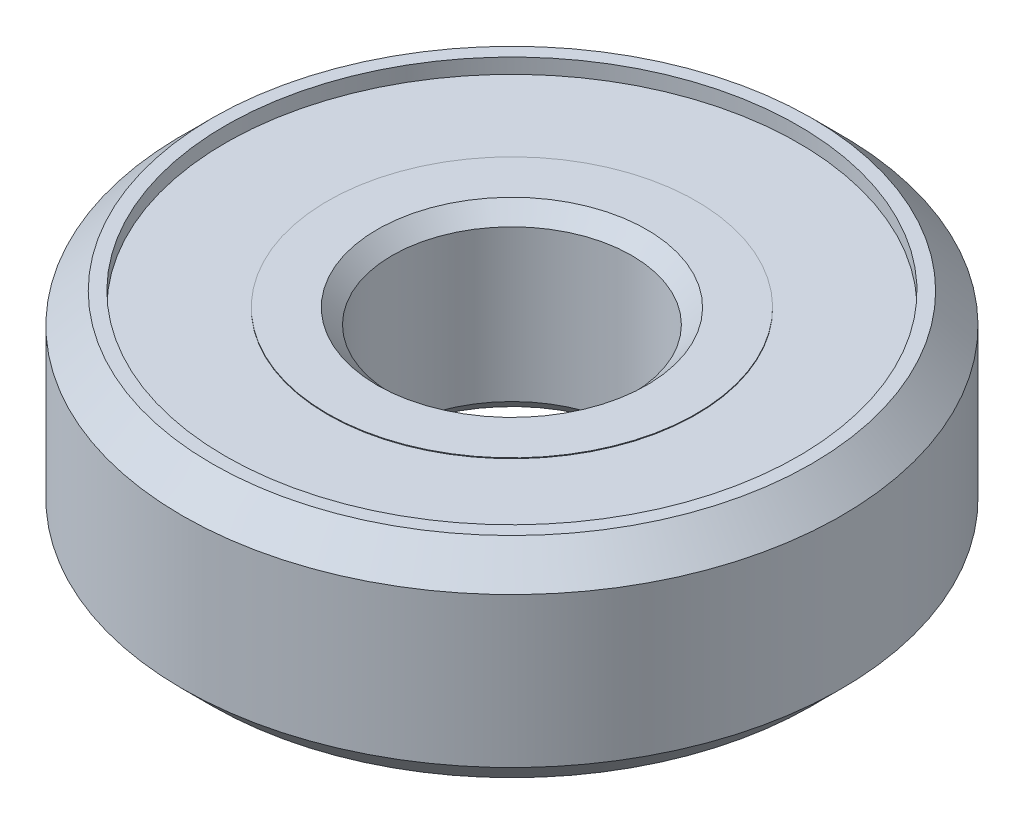
from build123d import *

# Parameters (mm, degrees)
SKETCH1_R                = 11
SKETCH1_R_2              = 4
BOSS_EXTRUDE1_DEPTH      = 7
CHAMFER1_SIZE            = 1
SKETCH2_R                = 9.560499877
CUT_EXTRUDE1_DEPTH       = 0.5
SKETCH3_R                = 6.152500931
SKETCH3_R_2              = 4
BOSS_EXTRUDE2_DEPTH      = 0.025
CHAMFER2_SIZE            = 0.5
CHAMFER2_OF_MIRROR3_SIZE = 0.5


with BuildPart() as part:
    # Sketch1 → Boss-Extrude1 (new body)
    with BuildSketch(Plane(origin=(0, 0, 0), x_dir=(1, 0, 0), z_dir=(0, 1, 0))):
        with Locations(Location((0, 0, 0), (0, 0, 270))):
            Circle(SKETCH1_R)
        with Locations(Location((0, 0, 0), (0, 0, 270))):
            Circle(SKETCH1_R_2, mode=Mode.SUBTRACT)
    extrude(amount=BOSS_EXTRUDE1_DEPTH)

    # Chamfer1
    chamfer1_edges = [part.edges().sort_by_distance(p)[0] for p in [
        (0, 0, -11),
        (0, 7, -11),
    ]]
    chamfer(chamfer1_edges, length=CHAMFER1_SIZE)

    # Sketch2 → Cut-Extrude1 (cut)
    with BuildSketch(Plane(origin=(0, 7, 0), x_dir=(1, 0, 0), z_dir=(0, 1, 0))):
        with Locations(Location((0, 0, 0), (0, 0, 270))):
            Circle(SKETCH2_R)
    cut_extrude1 = extrude(amount=-CUT_EXTRUDE1_DEPTH, mode=Mode.SUBTRACT)

    # Sketch3 → Boss-Extrude2 (add)
    with BuildSketch(Plane(origin=(0, 6.5, 0), x_dir=(1, 0, 0), z_dir=(0, 1, 0))):
        with Locations(Location((0, 0, 0), (0, 0, 270))):
            Circle(SKETCH3_R)
        with Locations(Location((0, 0, 0), (0, 0, 270))):
            Circle(SKETCH3_R_2, mode=Mode.SUBTRACT)
    boss_extrude2 = extrude(amount=BOSS_EXTRUDE2_DEPTH)

    # Chamfer2
    chamfer2_edges = [part.edges().sort_by_distance(p)[0] for p in [
        (0, 6.525, -4),
    ]]
    chamfer(chamfer2_edges, length=CHAMFER2_SIZE)

    # Mirror3: Cut-Extrude1, Boss-Extrude2 across plane
    add(cut_extrude1.mirror(Plane(origin=(0, 3.500000112, 0), x_dir=(0, 0, 1), z_dir=(0, -1, 0))), mode=Mode.SUBTRACT)
    add(boss_extrude2.mirror(Plane(origin=(0, 3.500000112, 0), x_dir=(0, 0, 1), z_dir=(0, -1, 0))))

    # Chamfer2 of Mirror3
    chamfer2_of_mirror3_edges = [part.edges().sort_by_distance(p)[0] for p in [
        (0, 0.475000224, -4),
    ]]
    chamfer(chamfer2_of_mirror3_edges, length=CHAMFER2_OF_MIRROR3_SIZE)


solid = part.part
